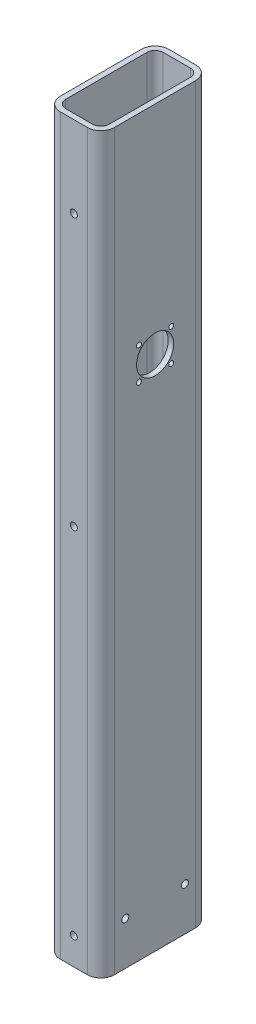
from build123d import *

# Parameters (mm, degrees)
RHS_C350_AS_100X50X5_0_RHS_C350_1_DEPTH = 677
SKETCH18_R                              = 3.25
CUT_EXTRUDE1_DEPTH                      = 354.846364966
SKETCH19_R                              = 17.1
CUT_EXTRUDE2_DEPTH                      = 10
SKETCH20_R                              = 22.5
CUT_EXTRUDE3_DEPTH                      = 10
SKETCH12_R                              = 2.25
CUT_EXTRUDE4_DEPTH                      = 10
SKETCH21_R                              = 3.25
CUT_EXTRUDE5_DEPTH                      = 346.806665638
SKETCH22_R                              = 3.25
CUT_EXTRUDE6_DEPTH                      = 354.846364966


with BuildPart() as part:
    # Sketch11 → Rhs c350 as 100X50X5.0 RHS C350(1) (new body)
    with BuildSketch(Plane(origin=(0, -338.5, 0), x_dir=(-1, 0, 0), z_dir=(0, 1, 0))):
        with BuildLine():
            Line((-12.5, -50), (12.5, -50))
            ThreePointArc((12.5, -50), (21.338834765, -46.338834765), (25, -37.5))
            Line((25, -37.5), (25, 37.5))
            ThreePointArc((25, 37.5), (21.338834765, 46.338834765), (12.5, 50))
            Line((12.5, 50), (-12.5, 50))
            ThreePointArc((-12.5, 50), (-21.338834765, 46.338834765), (-25, 37.5))
            Line((-25, 37.5), (-25, -37.5))
            ThreePointArc((-25, -37.5), (-21.338834765, -46.338834765), (-12.5, -50))
        make_face()
        with BuildLine():
            Line((-12.5, 45), (12.5, 45))
            ThreePointArc((12.5, 45), (17.803300859, 42.803300859), (20, 37.5))
            Line((20, 37.5), (20, -37.5))
            ThreePointArc((20, -37.5), (17.803300859, -42.803300859), (12.5, -45))
            Line((12.5, -45), (-12.5, -45))
            ThreePointArc((-12.5, -45), (-17.803300859, -42.803300859), (-20, -37.5))
            Line((-20, -37.5), (-20, 37.5))
            ThreePointArc((-20, 37.5), (-17.803300859, 42.803300859), (-12.5, 45))
        make_face(mode=Mode.SUBTRACT)
    extrude(amount=RHS_C350_AS_100X50X5_0_RHS_C350_1_DEPTH)

    # Sketch18 → Cut-Extrude1 (cut, through all)
    with BuildSketch(Plane(origin=(0, 0, -50), x_dir=(-1, 0, 0), z_dir=(0, 0, -1))):
        with Locations((0, 263.5)):
            Circle(SKETCH18_R)
        with Locations((0, 13.5)):
            Circle(SKETCH18_R)
    extrude(amount=-CUT_EXTRUDE1_DEPTH, mode=Mode.SUBTRACT)

    # Sketch19 → Cut-Extrude2 (cut)
    with BuildSketch(Plane(origin=(25, 0, 0), x_dir=(0, 0, -1), z_dir=(1, 0, 0))):
        with Locations(Location((0, 138.5, 0), (0, 0, 90))):
            Circle(SKETCH19_R)
    extrude(amount=-CUT_EXTRUDE2_DEPTH, mode=Mode.SUBTRACT)

    # Sketch20 → Cut-Extrude3 (cut)
    with BuildSketch(Plane.ZY.offset(25)):
        with Locations(Location((0, 138.5, 0), (0, 0, 270))):
            Circle(SKETCH20_R)
    extrude(amount=-CUT_EXTRUDE3_DEPTH, mode=Mode.SUBTRACT)

    # Sketch12 → Cut-Extrude4 (cut)
    with BuildSketch(Plane(origin=(25, 0, 0), x_dir=(0, 0, -1), z_dir=(1, 0, 0))):
        with Locations(Location((14.849242405, 153.349242405, 0), (0, 0, 90))):
            Circle(SKETCH12_R)
        with Locations(Location((-14.849242405, 153.349242405, 0), (0, 0, 90))):
            Circle(SKETCH12_R)
        with Locations(Location((-14.849242405, 123.650757595, 0), (0, 0, 90))):
            Circle(SKETCH12_R)
        with Locations(Location((14.849242405, 123.650757595, 0), (0, 0, 90))):
            Circle(SKETCH12_R)
    extrude(amount=-CUT_EXTRUDE4_DEPTH, mode=Mode.SUBTRACT)

    # Sketch21 → Cut-Extrude5 (cut, through all)
    with BuildSketch(Plane.ZY.offset(25)):
        with Locations(Location((-27.5, -298.5, 0), (0, 0, 270))):
            Circle(SKETCH21_R)
        with Locations(Location((27.5, -298.5, 0), (0, 0, 270))):
            Circle(SKETCH21_R)
    extrude(amount=-CUT_EXTRUDE5_DEPTH, mode=Mode.SUBTRACT)

    # Sketch22 → Cut-Extrude6 (cut, through all)
    with BuildSketch(Plane(origin=(0, 0, -50), x_dir=(-1, 0, 0), z_dir=(0, 0, -1))):
        with Locations((0, -313.5)):
            Circle(SKETCH22_R)
    extrude(amount=-CUT_EXTRUDE6_DEPTH, mode=Mode.SUBTRACT)


solid = part.part
